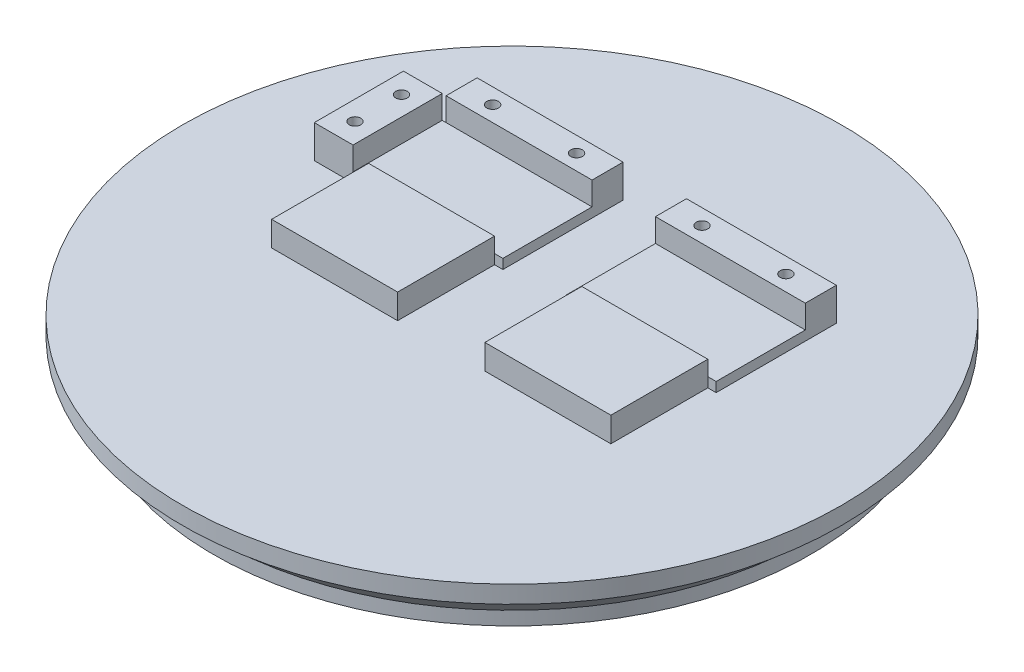
from build123d import *

# Parameters (mm, degrees)
SKETCH2_R           = 71
BOSS_EXTRUDE1_DEPTH = 11
SKETCH10_W          = 37.65
SKETCH10_H          = 8
SKETCH10_R          = 1.5
SKETCH10_W_2        = 10
SKETCH10_H_2        = 23
SKETCH10_W_3        = 1
BOSS_EXTRUDE6_DEPTH = 8.5
SKETCH12_R          = 57.5
SKETCH12_R_2        = 23.75
CUT_EXTRUDE8_DEPTH  = 1
SKETCH11_W          = 38.65
SKETCH11_H          = 23
BOSS_EXTRUDE7_DEPTH = 2.5
SKETCH14_W          = 32.5
SKETCH14_H          = 25
BOSS_EXTRUDE8_DEPTH = 6.4


with BuildPart() as part:
    # Sketch1 → Revolve1 (revolve)
    with BuildSketch(Plane.XY, mode=Mode.PRIVATE) as revolve1_sk:
        Polygon((0, 12), (0, 15), (85, 15), (85, 10.5), (84, 10.5), (77, 3.5), (77, 0), (71, 0), (71, 12), (23.75, 12), (23.75, -7.5), (21.25, -7.5), (21.25, 6), (6.5, 6), (6.5, 9), (0, 9), align=None)
    revolve(revolve1_sk.sketch.rotate(Axis((0, 12, 0), (0, -1, 0)), 180), axis=Axis((0, 12, 0), (0, -1, 0)))

    # Sketch2 → Boss-Extrude1 (add)
    with BuildSketch(Plane.XZ.offset(-12)):
        with Locations(Location((0, 0, 0), (0, 0, 180))):
            Circle(SKETCH2_R)
        Polygon((0, 70.292395274), (-60.875, 35.146197637), (-60.875, -35.146197637), (0, -70.292395274), (60.875, -35.146197637), (60.875, 35.146197637), align=None, mode=Mode.SUBTRACT)
    extrude(amount=BOSS_EXTRUDE1_DEPTH)

    # Sketch10 → Boss-Extrude6 (add)
    # profile 1 of 4: a face of its own
    with BuildSketch(Plane(origin=(0, 15, 0), x_dir=(1, 0, 0), z_dir=(0, 1, 0))):
        with Locations((-30.175, 36)):
            Rectangle(SKETCH10_W, SKETCH10_H)
        with Locations(Location((-41, 36, 0), (0, 0, 180))):
            Circle(SKETCH10_R, mode=Mode.SUBTRACT)
        with Locations(Location((-19.35, 36, 0), (0, 0, 180))):
            Circle(SKETCH10_R, mode=Mode.SUBTRACT)
    # profile 2 of 4: a face of its own
    with BuildSketch(Plane(origin=(0, 15, 0), x_dir=(1, 0, 0), z_dir=(0, 1, 0))):
        with Locations((-55, 20.5)):
            Rectangle(SKETCH10_W_2, SKETCH10_H_2)
        with Locations(Location((-55, 14.5, 0), (0, 0, 180))):
            Circle(SKETCH10_R, mode=Mode.SUBTRACT)
        with Locations(Location((-55, 26.5, 0), (0, 0, 180))):
            Circle(SKETCH10_R, mode=Mode.SUBTRACT)
    # profile 3 of 4: a face of its own
    with BuildSketch(Plane(origin=(0, 15, 0), x_dir=(1, 0, 0), z_dir=(0, 1, 0))):
        with Locations((23.825, 36)):
            Rectangle(SKETCH10_W, SKETCH10_H)
        with Locations(Location((13, 36, 0), (0, 0, 180))):
            Circle(SKETCH10_R, mode=Mode.SUBTRACT)
        with Locations(Location((34.65, 36, 0), (0, 0, 180))):
            Circle(SKETCH10_R, mode=Mode.SUBTRACT)
    # profile 4 of 4: a face of its own
    with BuildSketch(Plane(origin=(0, 15, 0), x_dir=(1, 0, 0), z_dir=(0, 1, 0))):
        with Locations((43.15, 36)):
            Rectangle(SKETCH10_W_3, SKETCH10_H)
    extrude(amount=BOSS_EXTRUDE6_DEPTH)

    # Sketch12 → Cut-Extrude8 (cut)
    with BuildSketch(Plane.XZ.offset(-12)):
        Circle(SKETCH12_R)
        with Locations(Location((0, 0, 0), (0, 0, 180))):
            Circle(SKETCH12_R_2, mode=Mode.SUBTRACT)
    extrude(amount=-CUT_EXTRUDE8_DEPTH, mode=Mode.SUBTRACT)

    # Sketch11 → Boss-Extrude7 (add)
    with BuildSketch(Plane(origin=(0, 15, 0), x_dir=(1, 0, 0), z_dir=(0, 1, 0))):
        with Locations((-30.675, 20.5)):
            Rectangle(SKETCH11_W, SKETCH11_H)
        with Locations((24.325, 20.5)):
            Rectangle(SKETCH11_W, SKETCH11_H)
    extrude(amount=BOSS_EXTRUDE7_DEPTH)

    # Sketch14 → Boss-Extrude8 (add)
    with BuildSketch(Plane(origin=(0, 15, 0), x_dir=(1, 0, 0), z_dir=(0, 1, 0))):
        with Locations((-29.75, -3.5)):
            Rectangle(SKETCH14_W, SKETCH14_H)
        with Locations((25.25, -3.5)):
            Rectangle(SKETCH14_W, SKETCH14_H)
    extrude(amount=BOSS_EXTRUDE8_DEPTH)


solid = part.part
